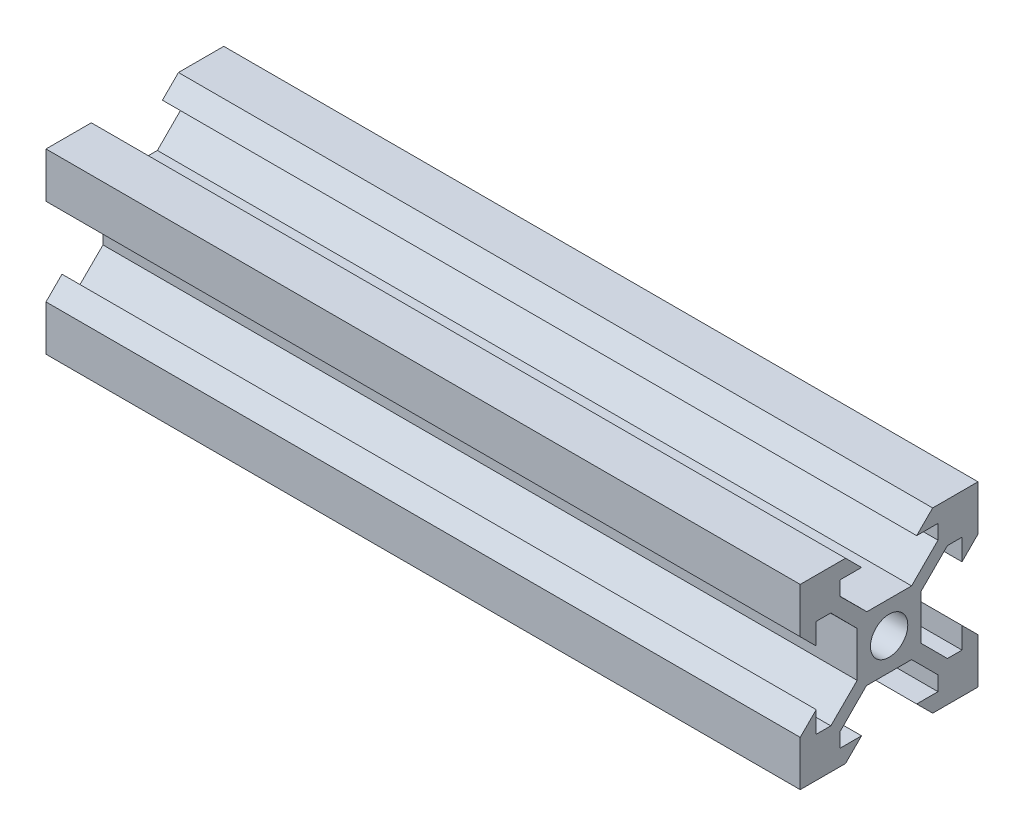
from build123d import *

# Parameters (mm, degrees)
BOSS_EXTRUDE1_DEPTH = 84.85
SKETCH2_R           = 2.1
CUT_EXTRUDE1_DEPTH  = 88.746923023


with BuildPart() as part:
    # Sketch1 → Boss-Extrude1 (new body)
    with BuildSketch(Plane(origin=(0, 0, 0), x_dir=(0, 0, -1), z_dir=(1, 0, 0))):
        Polygon((-10, 20), (-4.900000095, 20), (-3.099999905, 18.200000763), (-5.499340057, 18.200000763), (-5.499340057, 16.559999466), (-2.502582312, 13.590000153), (2.52933979, 13.590000153), (5.499340057, 16.559999466), (5.499340057, 18.200000763), (3.099999905, 18.200000763), (4.900000095, 20), (10, 20), (10, 14.899999619), (8.199999809, 13.100000381), (8.199999809, 15.499340057), (6.559999943, 15.499340057), (3.589999914, 12.52933979), (3.589999914, 7.47066021), (6.559999943, 4.500659943), (8.199999809, 4.500659943), (8.199999809, 6.900000095), (10, 5.099999905), (10, 0), (4.900000095, 0), (3.099999905, 1.799999952), (5.499340057, 1.799999952), (5.499340057, 3.440000057), (2.52933979, 6.409999847), (-2.555858612, 6.409999847), (-5.499340057, 3.440000057), (-5.499340057, 1.799999952), (-3.099999905, 1.799999952), (-4.900000095, 0), (-10, 0), (-10, 5.099999905), (-8.199999809, 6.899999951), (-8.199999809, 4.500659943), (-6.559999943, 4.500659943), (-3.589999914, 7.444141388), (-3.589999914, 12.50258255), (-6.559999943, 15.499340057), (-8.199999809, 15.499340057), (-8.199999809, 13.100000381), (-10, 14.899999619), align=None)
    extrude(amount=BOSS_EXTRUDE1_DEPTH)

    # Sketch2 → Cut-Extrude1 (cut, through all)
    with BuildSketch(Plane(origin=(84.85, 0, 0), x_dir=(0, 0, -1), z_dir=(1, 0, 0))):
        with Locations((5.9664e-05, 10)):
            Circle(SKETCH2_R)
    extrude(amount=-CUT_EXTRUDE1_DEPTH, mode=Mode.SUBTRACT)


solid = part.part
